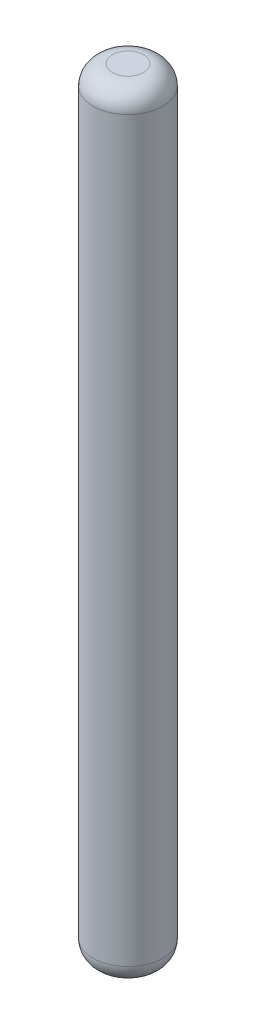
from build123d import *

# Parameters (mm, degrees)
SKETCH1_R           = 1.143
BOSS_EXTRUDE1_DEPTH = 25.4
FILLET2_R           = 0.635


with BuildPart() as part:
    # Sketch1 → Boss-Extrude1 (new body)
    with BuildSketch(Plane(origin=(0, 0, 0), x_dir=(1, 0, 0), z_dir=(0, 1, 0))):
        with Locations(Location((0, 0, 0), (0, 0, 270))):
            Circle(SKETCH1_R)
    extrude(amount=BOSS_EXTRUDE1_DEPTH)

    # Fillet2
    fillet2_edges = [part.edges().sort_by_distance(p)[0] for p in [
        (0, 0, -1.143),
        (0, 25.4, -1.143),
    ]]
    fillet(fillet2_edges, radius=FILLET2_R)


solid = part.part
